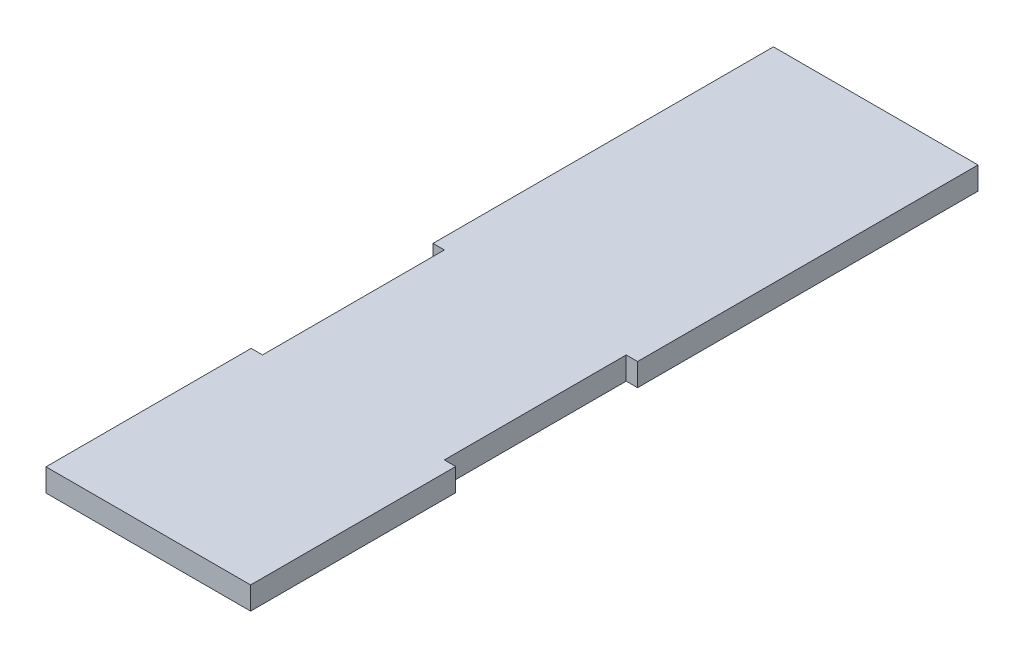
from build123d import *

# Parameters (mm, degrees)
BOSS_EXTRUDE1_DEPTH = 1.5875


with BuildPart() as part:
    # Sketch1 → Boss-Extrude1 (new body)
    with BuildSketch(Plane(origin=(0, 0, 0), x_dir=(1, 0, 0), z_dir=(0, 1, 0))):
        Polygon((-7.14375, -11.0744), (-7.14375, -25.4), (7.14375, -25.4), (7.14375, -11.0744), (6.35, -11.0744), (6.35, 1.6256), (7.14375, 1.6256), (7.14375, 25.4), (-7.14375, 25.4), (-7.14375, 1.6256), (-6.35, 1.6256), (-6.35, -11.0744), align=None)
    extrude(amount=BOSS_EXTRUDE1_DEPTH)


solid = part.part
